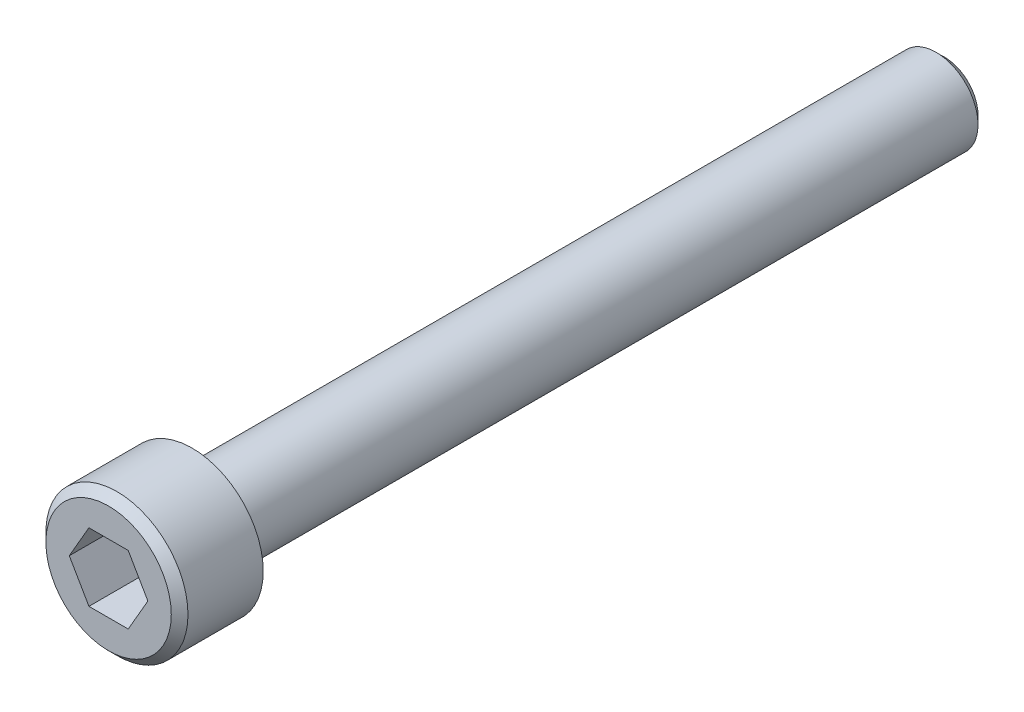
from build123d import *

# Parameters (mm, degrees)
CROQUIS1_R              = 4.25
SALIENTE_EXTRUIR1_DEPTH = 5
CROQUIS2_R              = 2.5
SALIENTE_EXTRUIR2_DEPTH = 45
CHAFL_N1_SIZE           = 0.5
CORTAR_EXTRUIR1_DEPTH   = 3.5


with BuildPart() as part:
    # Croquis1 → Saliente-Extruir1 (new body)
    with BuildSketch(Plane.XY):
        Circle(CROQUIS1_R)
    extrude(amount=SALIENTE_EXTRUIR1_DEPTH)

    # Croquis2 → Saliente-Extruir2 (add)
    with BuildSketch(Plane(origin=(0, 0, 0), x_dir=(-1, 0, 0), z_dir=(0, 0, -1))):
        with Locations(Location((0, 0, 0), (0, 0, 180))):
            Circle(CROQUIS2_R)
    extrude(amount=SALIENTE_EXTRUIR2_DEPTH)

    # Chaflán1
    chafl_n1_edges = [part.edges().sort_by_distance(p)[0] for p in [
        (-4.25, 0, 5),
        (-2.5, 0, -45),
    ]]
    chamfer(chafl_n1_edges, length=CHAFL_N1_SIZE)

    # Croquis3 → Cortar-Extruir1 (cut)
    with BuildSketch(Plane.XY.offset(5)):
        Polygon((2.35, 0), (1.175, 2.035159699), (-1.175, 2.035159699), (-2.35, 0), (-1.175, -2.035159699), (1.175, -2.035159699), align=None)
    extrude(amount=-CORTAR_EXTRUIR1_DEPTH, mode=Mode.SUBTRACT)


solid = part.part
